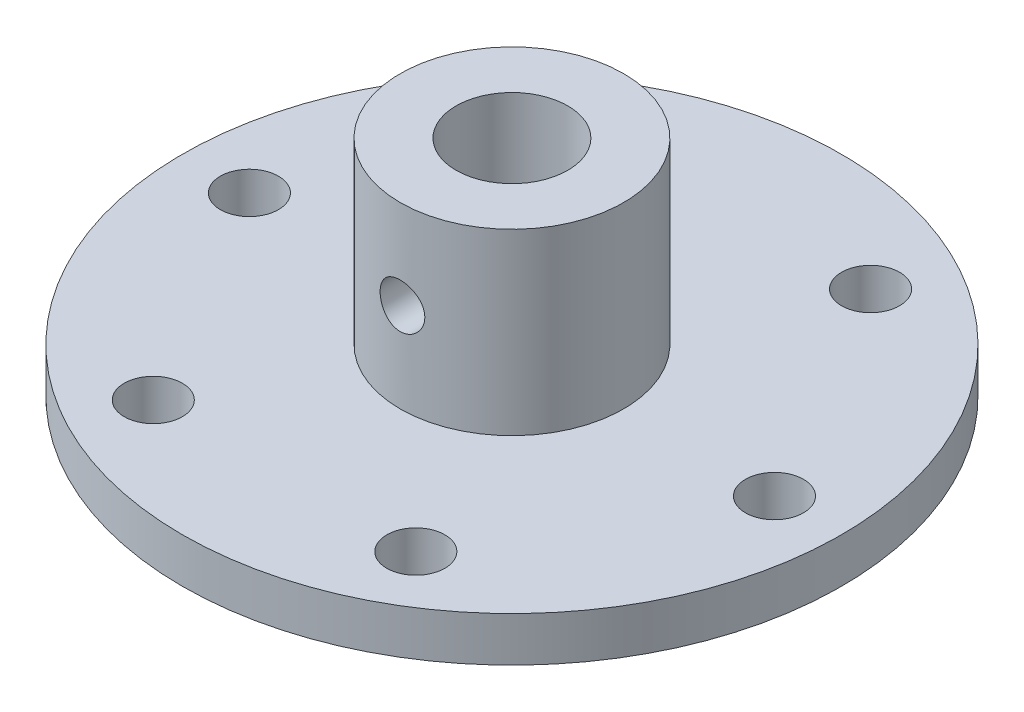
from build123d import *

# Parameters (mm, degrees)
SKETCH1_R               = 29.5
SKETCH1_R_2             = 2.6
SKETCH1_R_3             = 5
BOSS_EXTRUDE1_DEPTH     = 4
SKETCH1_3_R             = 10
SKETCH1_3_R_2           = 5
BOSS_EXTRUDE2_DEPTH     = 20
CUT_EXTRUDE1_DEPTH      = 47.265537931
CUT_EXTRUDE1_DEPTH_BACK = 47.265537931
SKETCH2_R               = 2


with BuildPart() as part:
    # Sketch1 → Boss-Extrude1 (new body)
    with BuildSketch(Plane(origin=(0, 0, 0), x_dir=(1, 0, 0), z_dir=(0, 1, 0))):
        Circle(SKETCH1_R)
        with Locations((-11.75, -20.351596989)):
            Circle(SKETCH1_R_2, mode=Mode.SUBTRACT)
        with Locations((11.75, -20.351596989)):
            Circle(SKETCH1_R_2, mode=Mode.SUBTRACT)
        with Locations((23.5, 0)):
            Circle(SKETCH1_R_2, mode=Mode.SUBTRACT)
        with Locations((-23.5, 0)):
            Circle(SKETCH1_R_2, mode=Mode.SUBTRACT)
        with Locations((-11.75, 20.351596989)):
            Circle(SKETCH1_R_2, mode=Mode.SUBTRACT)
        with Locations((11.75, 20.351596989)):
            Circle(SKETCH1_R_2, mode=Mode.SUBTRACT)
        Circle(SKETCH1_R_3, mode=Mode.SUBTRACT)
    extrude(amount=BOSS_EXTRUDE1_DEPTH)

    # Sketch1<3> → Boss-Extrude2 (add)
    with BuildSketch(Plane(origin=(0, 0, 0), x_dir=(1, 0, 0), z_dir=(0, 1, 0))):
        Circle(SKETCH1_3_R)
        Circle(SKETCH1_3_R_2, mode=Mode.SUBTRACT)
    extrude(amount=BOSS_EXTRUDE2_DEPTH)

    # Sketch2 → Cut-Extrude1 (cut, two sides: drawn at the far end of the back side and taken through both)
    with BuildSketch(Plane.XY.offset(-CUT_EXTRUDE1_DEPTH_BACK)):
        with Locations((0, 12)):
            Circle(SKETCH2_R)
    extrude(amount=CUT_EXTRUDE1_DEPTH + CUT_EXTRUDE1_DEPTH_BACK, mode=Mode.SUBTRACT)


solid = part.part
